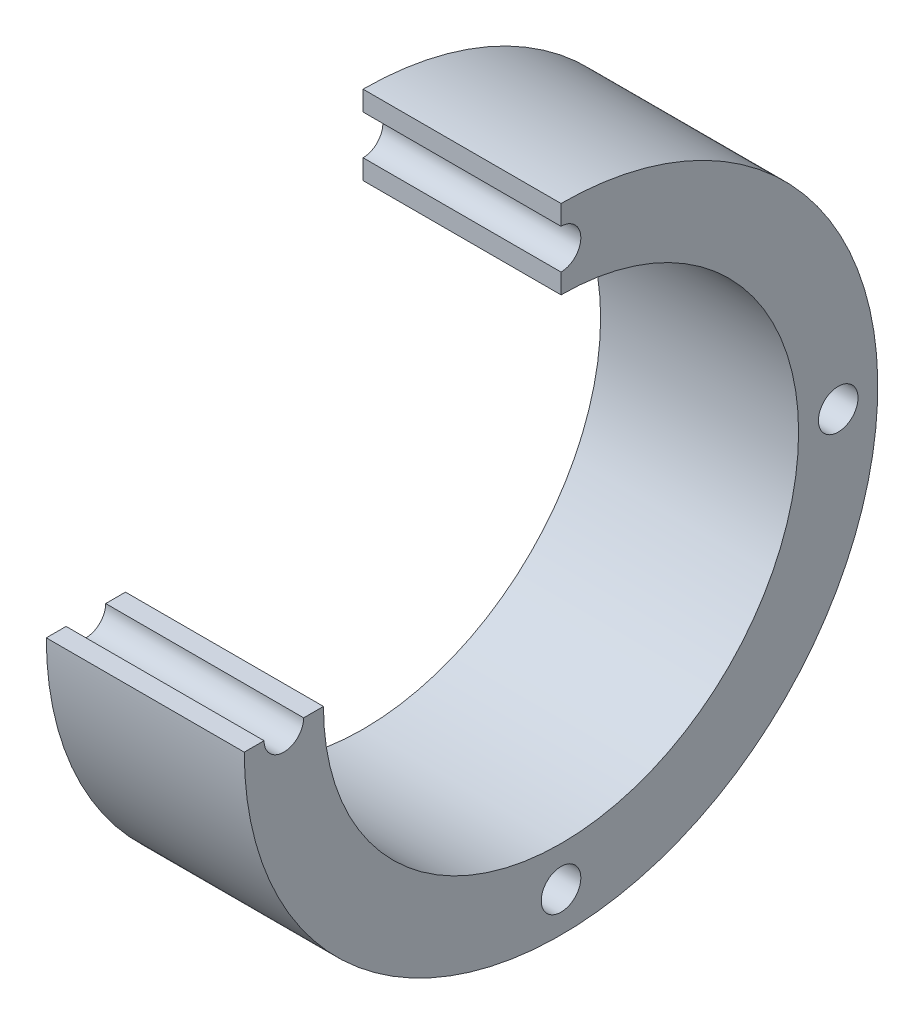
from build123d import *

# Parameters (mm, degrees)
SKETCH1_R           = 80
SKETCH1_R_2         = 60
BOSS_EXTRUDE1_DEPTH = 25
SKETCH2_R           = 5
CUT_EXTRUDE1_DEPTH  = 124.693168769
CIRPATTERN1_COUNT   = 4
CUT_EXTRUDE2_DEPTH  = 124.693168769


with BuildPart() as part:
    # Sketch1 → Boss-Extrude1 (new, symmetric)
    with BuildSketch(Plane.YZ):
        with Locations(Location((0, 0, 0), (0, 0, 270))):
            Circle(SKETCH1_R)
        with Locations(Location((0, 0, 0), (0, 0, 270))):
            Circle(SKETCH1_R_2, mode=Mode.SUBTRACT)
    extrude(amount=BOSS_EXTRUDE1_DEPTH, both=True)

    # Sketch2 → Cut-Extrude1 (cut, through all)
    with BuildSketch(Plane.YZ.offset(25)):
        with Locations(Location((-70, 0, 0), (0, 0, 270))):
            Circle(SKETCH2_R)
    cut_extrude1 = extrude(amount=-CUT_EXTRUDE1_DEPTH, mode=Mode.SUBTRACT)

    # CirPattern1: Cut-Extrude1 ×4 about axis
    cirpattern1_axis = Axis((0, 0, 0), (1, 0, 0))
    for i in range(1, CIRPATTERN1_COUNT):
        add(cut_extrude1.rotate(cirpattern1_axis, i * 360 / CIRPATTERN1_COUNT), mode=Mode.SUBTRACT)

    # Sketch3 → Cut-Extrude2 (cut, through all)
    with BuildSketch(Plane.YZ.offset(25)):
        Polygon((0, 93.474358871), (0, 0), (100.664694168, 0), (100.664694168, 96.534076019), align=None)
    extrude(amount=-CUT_EXTRUDE2_DEPTH, mode=Mode.SUBTRACT)


solid = part.part
